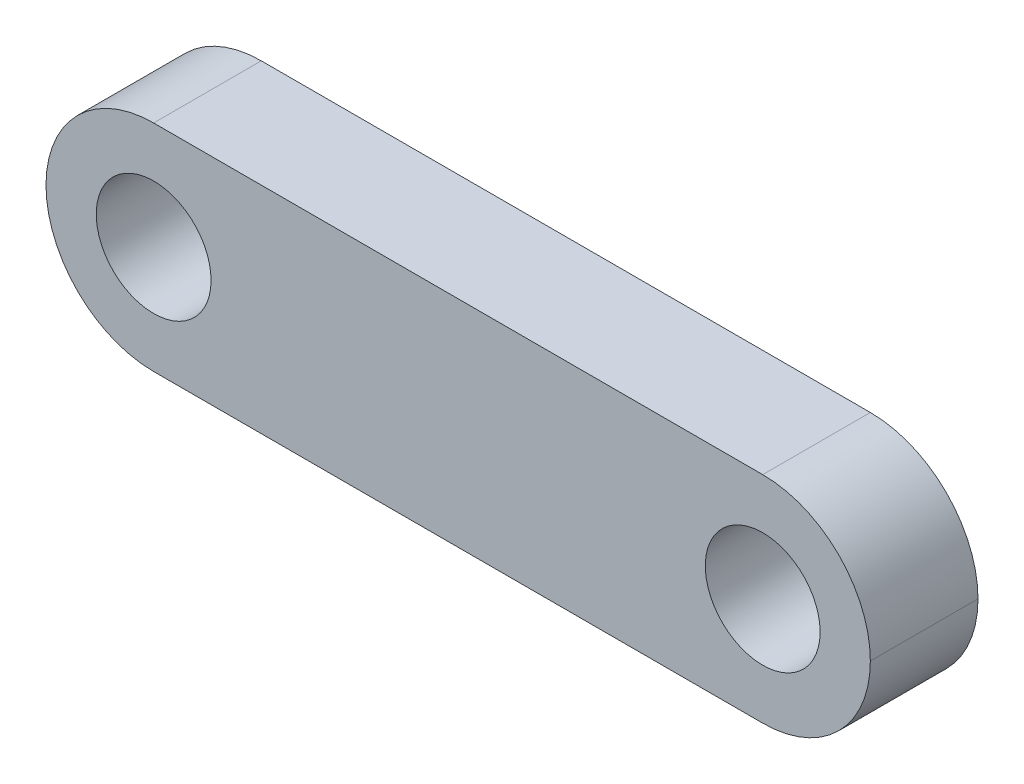
from build123d import *

# Parameters (mm, degrees)
SKETCH_1_R          = 1.35
EXTRUDE_1_DEPTH     = 3
SKETCH_2_R          = 1.6
CUT_EXTRUDE_1_DEPTH = 14.922339711


with BuildPart() as part:
    # 草图1 → 凸台-拉伸1 (new body)
    with BuildSketch(Plane.XY.offset(3)):
        with BuildLine():
            Line((7.774087989, 5.999), (-9.200145164, 5.999))
            ThreePointArc((-9.200145164, 5.999), (-11.321465508, 5.120320344), (-12.200145164, 2.999))
            ThreePointArc((-12.200145164, 2.999), (-11.321112092, 0.878326133), (-9.200145331, 0))
            Line((-9.200145331, 0), (7.774087823, 0))
            ThreePointArc((7.774087823, 0), (9.895408166, 0.878679656), (10.774087823, 3))
            ThreePointArc((10.774087823, 3), (9.89505475, 5.120673867), (7.774087989, 5.999))
        make_face()
        with Locations((7.774087823, 3)):
            Circle(SKETCH_1_R, mode=Mode.SUBTRACT)
        with Locations((-9.200145331, 3)):
            Circle(SKETCH_1_R, mode=Mode.SUBTRACT)
    extrude(amount=-EXTRUDE_1_DEPTH)

    # 草图2 → 切除-拉伸1 (cut, through all)
    with BuildSketch(Plane.XY.offset(3)):
        with Locations((-9.200145331, 3)):
            Circle(SKETCH_2_R)
        with Locations((7.774087989, 2.999)):
            Circle(SKETCH_2_R)
    extrude(amount=-CUT_EXTRUDE_1_DEPTH, mode=Mode.SUBTRACT)


solid = part.part
